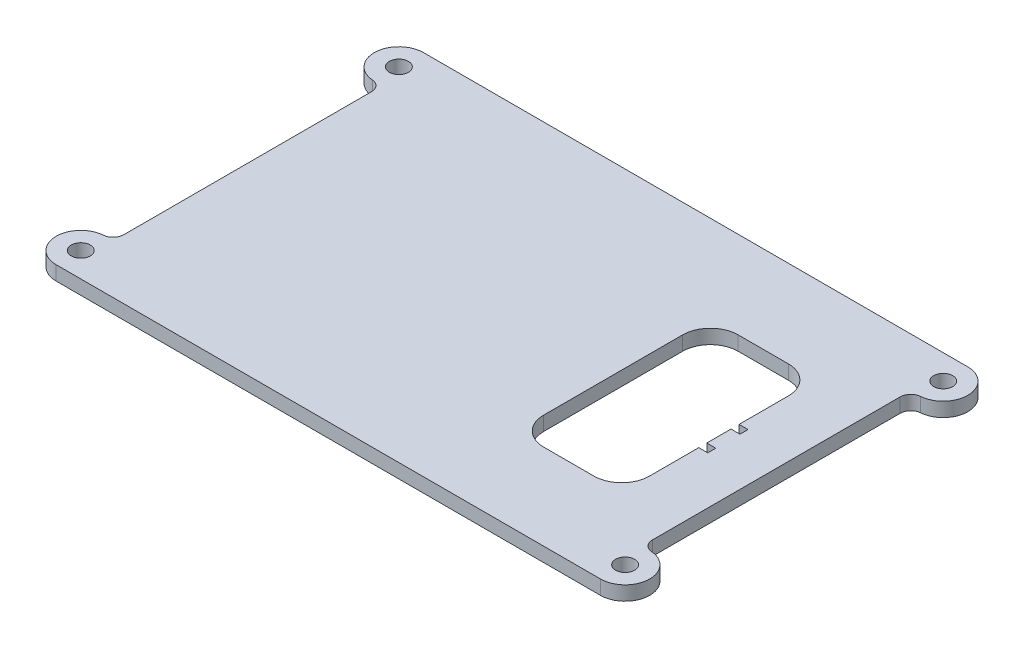
from build123d import *

# Parameters (mm, degrees)
SKETCH1_R           = 2.125
BOSS_EXTRUDE1_DEPTH = 3.175


with BuildPart() as part:
    # Sketch1 → Boss-Extrude1 (new body)
    with BuildSketch(Plane(origin=(0, 0, 0), x_dir=(1, 0, 0), z_dir=(0, 1, 0))):
        with BuildLine():
            Line((52.831908676, -29.265059171), (52.831908676, 26.025389594))
            ThreePointArc((52.831908676, 26.025389594), (53.463014101, 27.639628661), (55.021629488, 28.397771062))
            ThreePointArc((55.021629488, 28.397771062), (60.077505451, 34.100201776), (54.581908676, 39.380165211))
            Line((54.581908676, 39.380165211), (-66.918091324, 39.380165211))
            ThreePointArc((-66.918091324, 39.380165211), (-72.413688099, 34.100201776), (-67.357812136, 28.397771062))
            ThreePointArc((-67.357812136, 28.397771062), (-65.799196749, 27.639628661), (-65.168091324, 26.025389594))
            Line((-65.168091324, 26.025389594), (-65.168091324, -29.265059171))
            ThreePointArc((-65.168091324, -29.265059171), (-65.799196749, -30.879298239), (-67.357812136, -31.63744064))
            ThreePointArc((-67.357812136, -31.63744064), (-72.413688099, -37.339871353), (-66.918091324, -42.619834789))
            Line((-66.918091324, -42.619834789), (54.581908676, -42.619834789))
            ThreePointArc((54.581908676, -42.619834789), (60.077505451, -37.339871353), (55.021629488, -31.63744064))
            ThreePointArc((55.021629488, -31.63744064), (53.463014101, -30.879298239), (52.831908676, -29.265059171))
        make_face()
        with Locations(Location((-66.918091324, 33.880165211, 0), (0, 0, 270))):
            Circle(SKETCH1_R, mode=Mode.SUBTRACT)
        with Locations(Location((54.581908676, 33.880165211, 0), (0, 0, 270))):
            Circle(SKETCH1_R, mode=Mode.SUBTRACT)
        with Locations(Location((54.581908676, -37.119834789, 0), (0, 0, 270))):
            Circle(SKETCH1_R, mode=Mode.SUBTRACT)
        with Locations(Location((-66.918091324, -37.119834789, 0), (0, 0, 270))):
            Circle(SKETCH1_R, mode=Mode.SUBTRACT)
        with BuildLine():
            Line((40.163908241, -6.264833275), (42.163908241, -6.264833251))
            Line((42.163908241, -6.264833251), (42.16390822, -4.464833251))
            Line((42.16390822, -4.464833251), (40.16390822, -4.464833275))
            Line((40.16390822, -4.464833275), (40.163908156, 0.935166725))
            Line((40.163908156, 0.935166725), (42.163908156, 0.935166749))
            Line((42.163908156, 0.935166749), (42.163908134, 2.735166749))
            Line((42.163908134, 2.735166749), (40.163908134, 2.735166725))
            Line((40.163908134, 2.735166725), (40.163908003, 13.735166725))
            ThreePointArc((40.163908003, 13.735166725), (38.347969994, 18.119228747), (33.963907929, 19.935166651))
            Line((33.963907929, 19.935166651), (22.763907929, 19.935166518))
            ThreePointArc((22.763907929, 19.935166518), (18.379845907, 18.119228509), (16.563908003, 13.735166444))
            Line((16.563908003, 13.735166444), (16.563908373, -17.264833556))
            ThreePointArc((16.563908373, -17.264833556), (18.379846382, -21.648895578), (22.763908447, -23.464833482))
            Line((22.763908447, -23.464833482), (33.963908447, -23.464833349))
            ThreePointArc((33.963908447, -23.464833349), (38.347970468, -21.64889534), (40.163908373, -17.264833275))
            Line((40.163908373, -17.264833275), (40.163908241, -6.264833275))
        make_face(mode=Mode.SUBTRACT)
    extrude(amount=BOSS_EXTRUDE1_DEPTH)


solid = part.part
